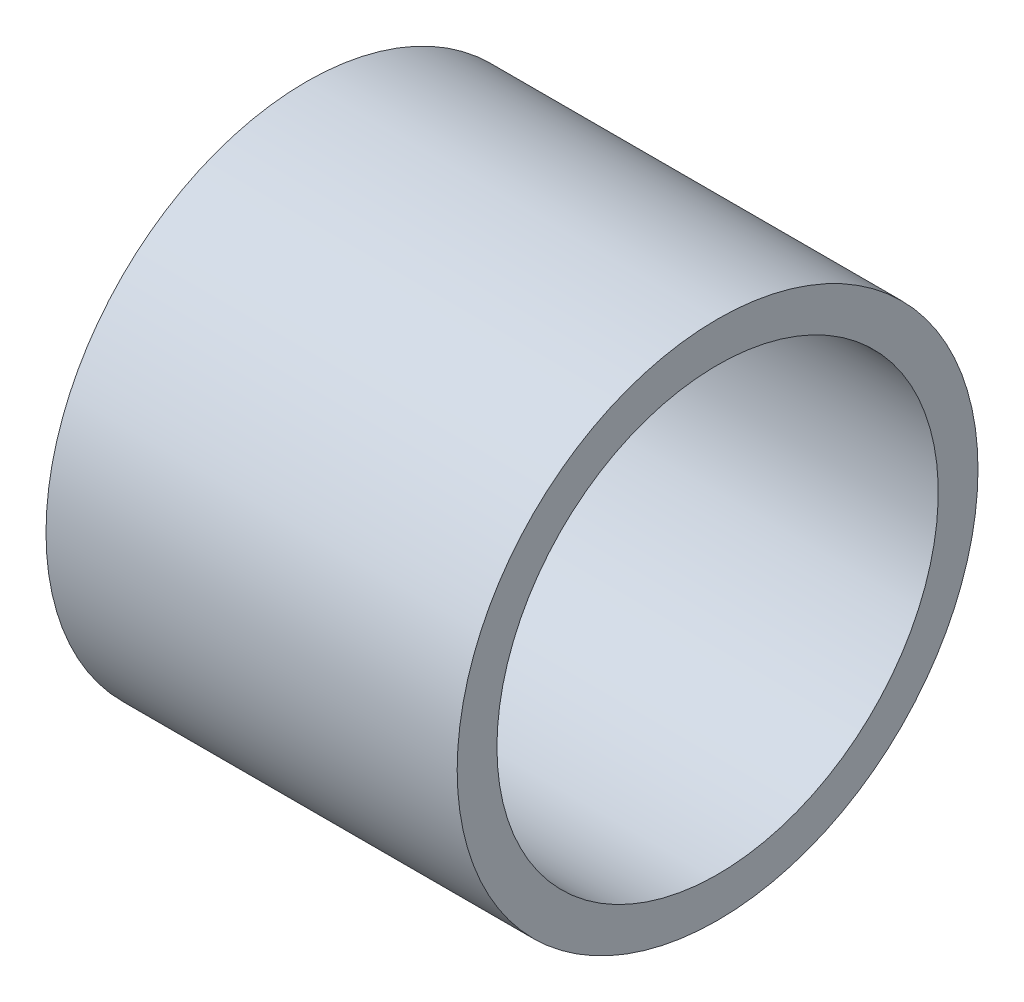
from build123d import *

# Parameters (mm, degrees)
SKETCH1_R           = 24.13
SKETCH1_R_2         = 20.447
BOSS_EXTRUDE1_DEPTH = 38.1


with BuildPart() as part:
    # Sketch1 → Boss-Extrude1 (new body)
    with BuildSketch(Plane(origin=(0, 0, 0), x_dir=(0, 0, -1), z_dir=(1, 0, 0))):
        with Locations(Location((0, 0, 0), (0, 0, 180))):
            Circle(SKETCH1_R)
        with Locations(Location((0, 0, 0), (0, 0, 180))):
            Circle(SKETCH1_R_2, mode=Mode.SUBTRACT)
    extrude(amount=BOSS_EXTRUDE1_DEPTH)


solid = part.part
